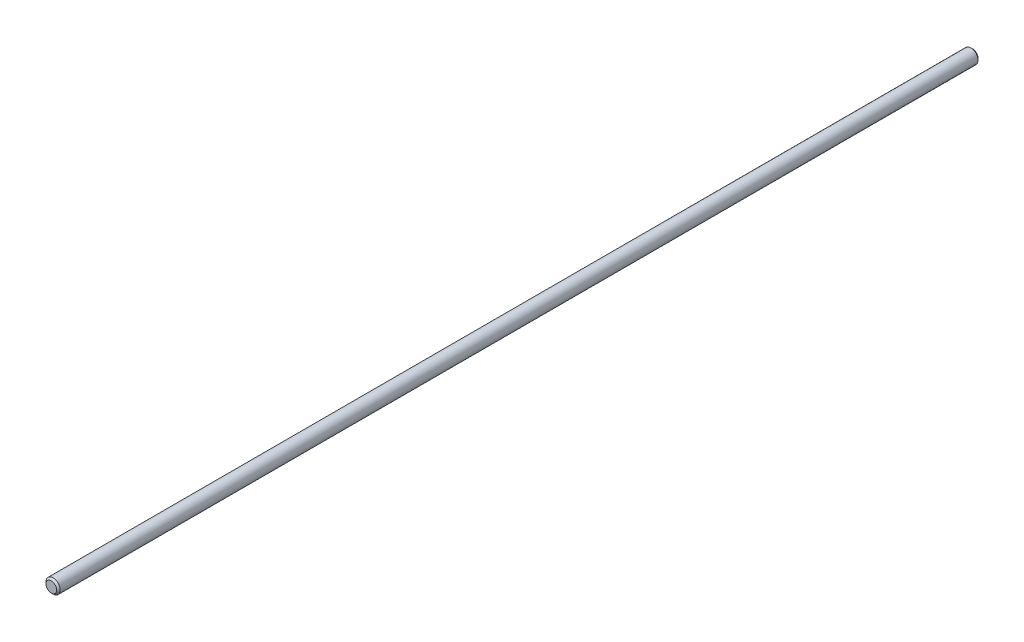
from build123d import *

# Parameters (mm, degrees)
SKETCH_1_R      = 2
EXTRUDE_1_DEPTH = 260
CHAMFER_1_SIZE  = 0.5


with BuildPart() as part:
    # 草图1 → 凸台-拉伸1 (new body)
    with BuildSketch(Plane.XY):
        Circle(SKETCH_1_R)
    extrude(amount=-EXTRUDE_1_DEPTH)

    # 倒角1
    chamfer_1_edges = [part.edges().sort_by_distance(p)[0] for p in [
        (-2, 0, 0),
        (-2, 0, -260),
    ]]
    chamfer(chamfer_1_edges, length=CHAMFER_1_SIZE)


solid = part.part
